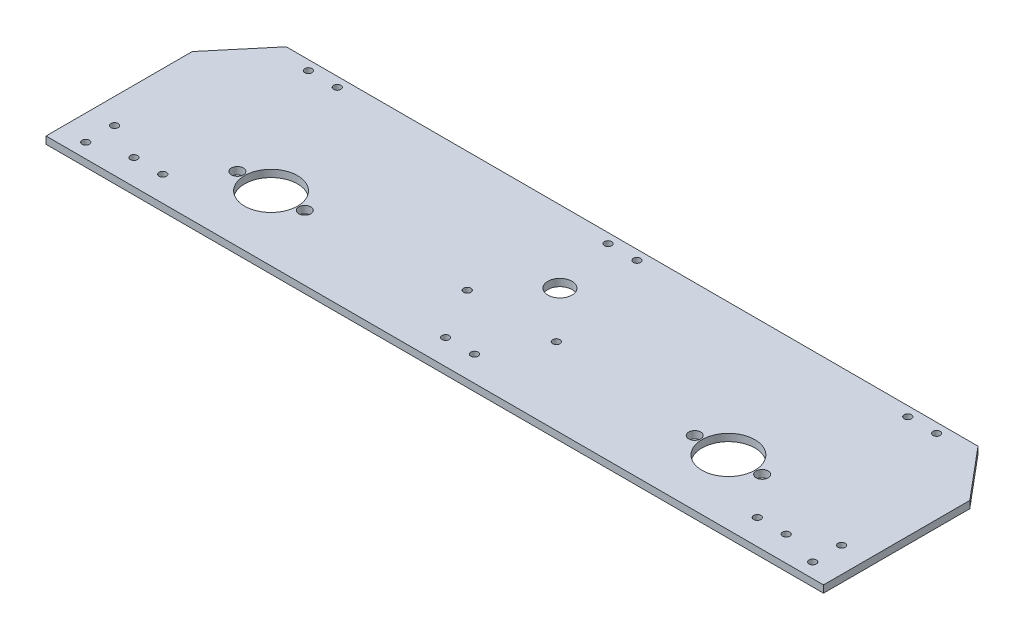
from build123d import *

# Parameters (mm, degrees)
SKETCH_1_R          = 11
SKETCH_1_R_2        = 2.5
EXTRUDE_1_DEPTH     = 3
SKETCH_2_R          = 1.5
CUT_EXTRUDE_1_DEPTH = 401.392640069
SKETCH_3_R          = 1.5
CUT_EXTRUDE_2_DEPTH = 10
SKETCH_4_R          = 1.494410779
SKETCH_4_R_2        = 1.5
CUT_EXTRUDE_3_DEPTH = 615.946278901
SKETCH_6_R          = 5
CUT_EXTRUDE_5_DEPTH = 401.392640069


with BuildPart() as part:
    # 草图1 → 凸台-拉伸1 (new body)
    with BuildSketch(Plane(origin=(0, 0, 0), x_dir=(1, 0, 0), z_dir=(0, 1, 0))):
        Polygon((68.894458013, 60.758817204), (86.717926663, 82), (374.070989363, 82), (391.894458013, 60.758817204), (391.894458013, 0), (68.894458013, 0), align=None)
        with Locations(Location((135.394458013, 27, 0), (0, 0, 270))):
            Circle(SKETCH_1_R, mode=Mode.SUBTRACT)
        with Locations(Location((311.394458013, 27, 0), (0, 0, 90))):
            Circle(SKETCH_1_R_2, mode=Mode.SUBTRACT)
        with Locations(Location((339.394458013, 27, 0), (0, 0, 90))):
            Circle(SKETCH_1_R_2, mode=Mode.SUBTRACT)
        with Locations(Location((325.394458013, 27, 0), (0, 0, 90))):
            Circle(SKETCH_1_R, mode=Mode.SUBTRACT)
        with Locations(Location((121.394458013, 27, 0), (0, 0, 270))):
            Circle(SKETCH_1_R_2, mode=Mode.SUBTRACT)
        with Locations(Location((149.394458013, 27, 0), (0, 0, 270))):
            Circle(SKETCH_1_R_2, mode=Mode.SUBTRACT)
    extrude(amount=EXTRUDE_1_DEPTH)

    # 草图2 → 切除-拉伸1 (cut, through all)
    with BuildSketch(Plane(origin=(0, 3, 0), x_dir=(1, 0, 0), z_dir=(0, 1, 0))):
        with Locations(Location((236.394458013, 10.5, 0), (0, 0, 270))):
            Circle(SKETCH_2_R)
        with Locations(Location((353.894458013, 10.5, 0), (0, 0, 270))):
            Circle(SKETCH_2_R)
        with Locations(Location((365.894458013, 10.5, 0), (0, 0, 270))):
            Circle(SKETCH_2_R)
        with Locations(Location((381.394458013, 6, 0), (0, 0, 270))):
            Circle(SKETCH_2_R)
        with Locations(Location((381.394458013, 18, 0), (0, 0, 270))):
            Circle(SKETCH_2_R)
        with Locations(Location((79.394458013, 18, 0), (0, 0, 90))):
            Circle(SKETCH_2_R)
        with Locations(Location((79.394458013, 6, 0), (0, 0, 90))):
            Circle(SKETCH_2_R)
        with Locations(Location((94.894458013, 10.5, 0), (0, 0, 90))):
            Circle(SKETCH_2_R)
        with Locations(Location((106.894458013, 10.5, 0), (0, 0, 90))):
            Circle(SKETCH_2_R)
        with Locations(Location((224.394458013, 10.5, 0), (0, 0, 90))):
            Circle(SKETCH_2_R)
    extrude(amount=-CUT_EXTRUDE_1_DEPTH, mode=Mode.SUBTRACT)

    # 草图3 → 切除-拉伸2 (cut)
    with BuildSketch(Plane(origin=(0, 3, 0), x_dir=(1, 0, 0), z_dir=(0, 1, 0))):
        with Locations(Location((248.894458013, 32, 0), (0, 0, 270))):
            Circle(SKETCH_3_R)
        with Locations(Location((211.894458013, 32, 0), (0, 0, 270))):
            Circle(SKETCH_3_R)
    extrude(amount=-CUT_EXTRUDE_2_DEPTH, mode=Mode.SUBTRACT)

    # 草图4 → 切除-拉伸3 (cut, through all)
    with BuildSketch(Plane(origin=(-213.132295014, -49, -96.940982333), x_dir=(1, 0, 0), z_dir=(0, -1, 0))):
        with Locations((449.526753027, 18.940982333)):
            Circle(SKETCH_4_R)
        with Locations((437.526753027, 18.940982333)):
            Circle(SKETCH_4_R_2)
        with Locations((562.026753027, 18.940982333)):
            Circle(SKETCH_4_R_2)
        with Locations((574.026753027, 18.940982333)):
            Circle(SKETCH_4_R_2)
        with Locations((325.026753027, 18.940982333)):
            Circle(SKETCH_4_R_2)
        with Locations((313.026753027, 18.940982333)):
            Circle(SKETCH_4_R_2)
    extrude(amount=-CUT_EXTRUDE_3_DEPTH, mode=Mode.SUBTRACT)

    # 草图6 → 切除-拉伸5 (cut, through all)
    with BuildSketch(Plane(origin=(0, 3, 0), x_dir=(1, 0, 0), z_dir=(0, 1, 0))):
        with Locations(Location((230.394458013, 52, 0), (0, 0, 270))):
            Circle(SKETCH_6_R)
    extrude(amount=-CUT_EXTRUDE_5_DEPTH, mode=Mode.SUBTRACT)


solid = part.part
